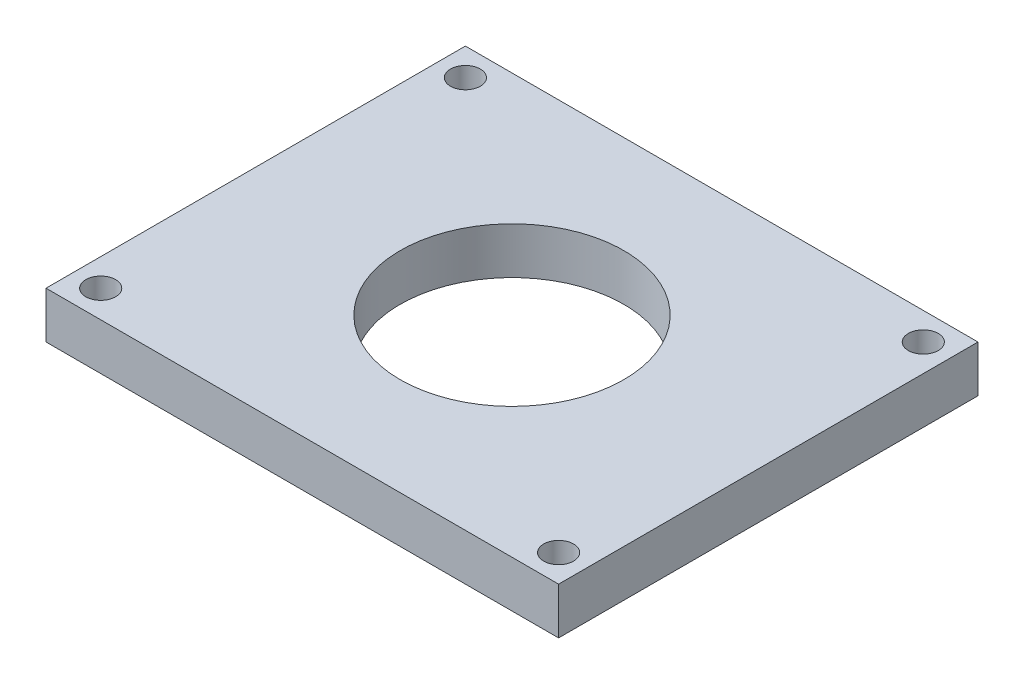
from build123d import *

# Parameters (mm, degrees)
SKETCH1_W           = 55
SKETCH1_H           = 45
BOSS_EXTRUDE1_DEPTH = 5
SKETCH2_R           = 12
CUT_EXTRUDE1_DEPTH  = 5
SKETCH3_R           = 1.6
CUT_EXTRUDE2_DEPTH  = 10


with BuildPart() as part:
    # Sketch1 → Boss-Extrude1 (new body)
    with BuildSketch(Plane(origin=(0, 0, 0), x_dir=(1, 0, 0), z_dir=(0, 1, 0))):
        with Locations((27.5, -22.5)):
            Rectangle(SKETCH1_W, SKETCH1_H)
    extrude(amount=BOSS_EXTRUDE1_DEPTH)

    # Sketch2 → Cut-Extrude1 (cut)
    with BuildSketch(Plane(origin=(0, 5, 0), x_dir=(1, 0, 0), z_dir=(0, 1, 0))):
        with Locations((27.5, -22.5)):
            Circle(SKETCH2_R)
    extrude(amount=-CUT_EXTRUDE1_DEPTH, mode=Mode.SUBTRACT)

    # Sketch3 → Cut-Extrude2 (cut)
    with BuildSketch(Plane(origin=(0, 5, 0), x_dir=(1, 0, 0), z_dir=(0, 1, 0))):
        with Locations((2.935211994, -2.935211994)):
            Circle(SKETCH3_R)
        with Locations((52.064788006, -2.935211994)):
            Circle(SKETCH3_R)
        with Locations((52.064788006, -42.064788006)):
            Circle(SKETCH3_R)
        with Locations((2.935211994, -42.064788006)):
            Circle(SKETCH3_R)
    extrude(amount=-CUT_EXTRUDE2_DEPTH, mode=Mode.SUBTRACT)


solid = part.part
